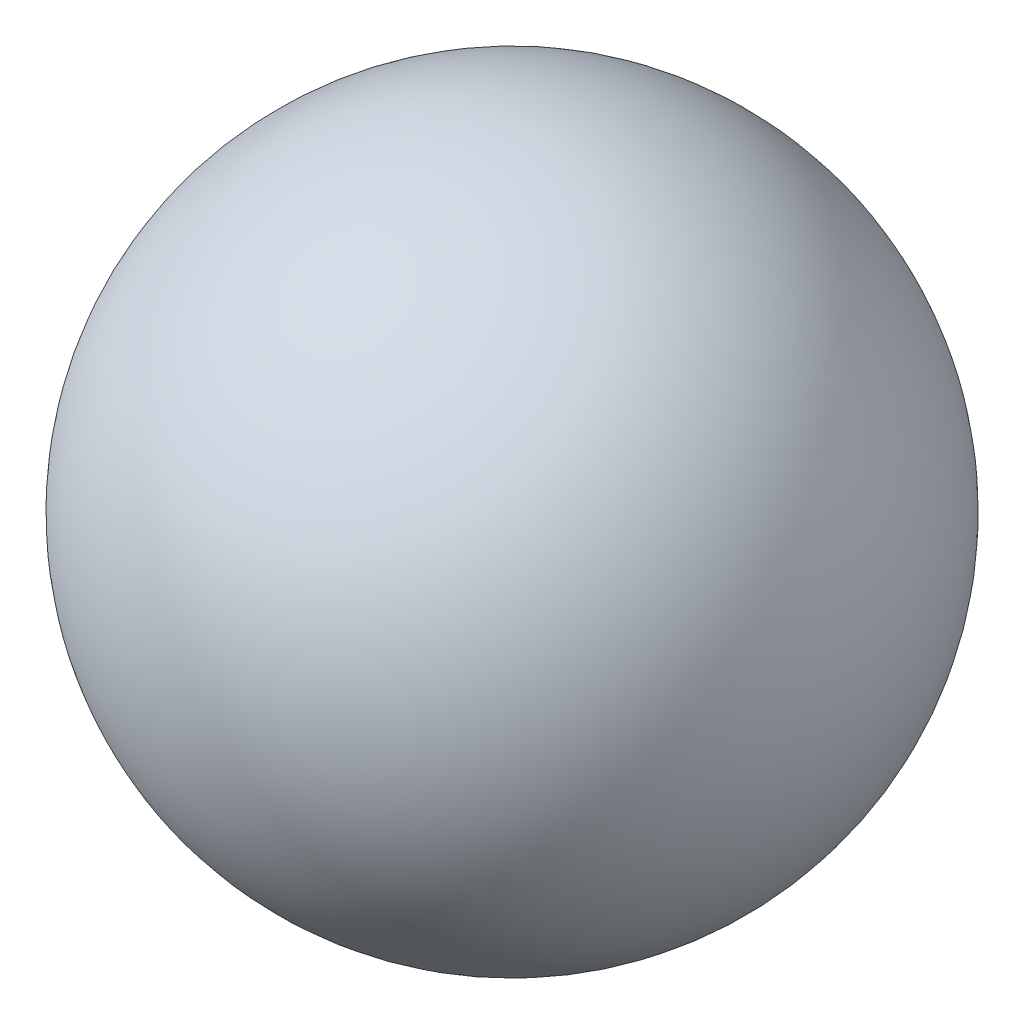
from build123d import *


with BuildPart() as part:
    # Sketch1 → Revolve1 (revolve)
    with BuildSketch(Plane(origin=(0, 0, 0), x_dir=(1, 0, 0), z_dir=(0, 1, 0))):
        with BuildLine():
            Line((0, 7.62), (0, -7.62))
            ThreePointArc((0, -7.62), (7.62, 0), (0, 7.62))
        make_face()
    revolve(axis=Axis((0, 0, 15.134316621), (0, 0, -1)))


solid = part.part
